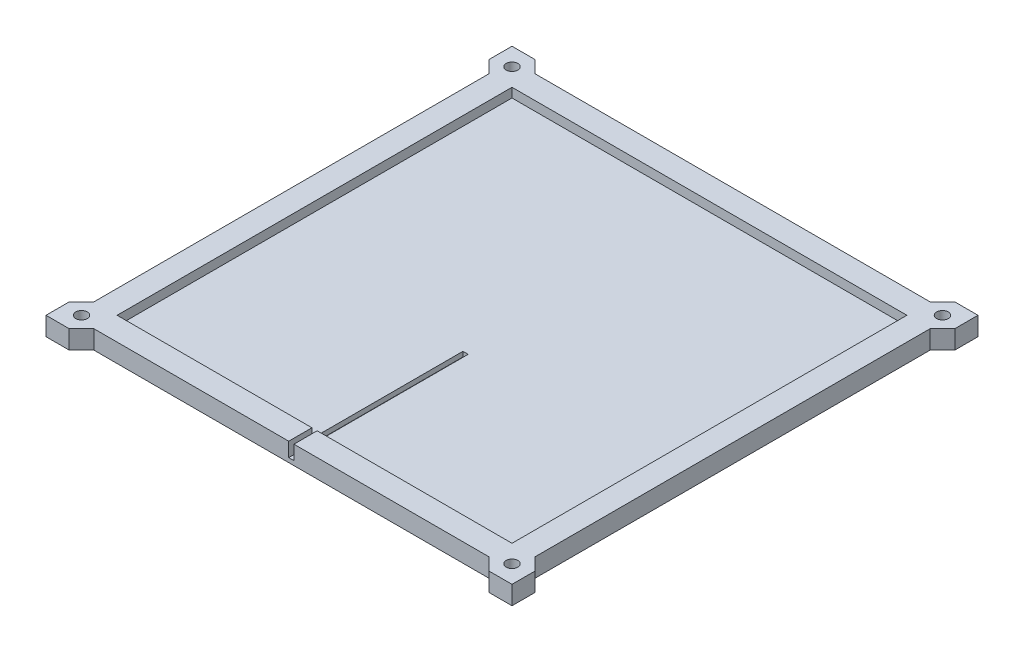
from build123d import *

# Parameters (mm, degrees)
SKETCH1_W            = 380
SKETCH1_H            = 380
BOSS_EXTRUDE1_DEPTH  = 8
SKETCH2_W            = 380
SKETCH2_H            = 380
SKETCH2_W_2          = 340
SKETCH2_H_2          = 340
BOSS_EXTRUDE2_DEPTH  = 8
BOSS_EXTRUDE3_DEPTH  = 16
MIRROR2_COPY_1_DEPTH = 16
SKETCH6_R            = 5
CUT_EXTRUDE1_DEPTH   = 16
SKETCH8_W            = 4.5
SKETCH8_H            = 30
CUT_EXTRUDE2_DEPTH   = 150


with BuildPart() as part:
    # Sketch1 → Boss-Extrude1 (new body)
    with BuildSketch(Plane(origin=(0, 0, 0), x_dir=(1, 0, 0), z_dir=(0, 1, 0))):
        Rectangle(SKETCH1_W, SKETCH1_H)
    extrude(amount=BOSS_EXTRUDE1_DEPTH)

    # Sketch2 → Boss-Extrude2 (add)
    with BuildSketch(Plane(origin=(0, 8, 0), x_dir=(1, 0, 0), z_dir=(0, 1, 0))):
        Rectangle(SKETCH2_W, SKETCH2_H)
        Rectangle(SKETCH2_W_2, SKETCH2_H_2, mode=Mode.SUBTRACT)
    extrude(amount=BOSS_EXTRUDE2_DEPTH)

    # Sketch3 → Boss-Extrude3 (add)
    with BuildSketch(Plane(origin=(0, 16, 0), x_dir=(1, 0, 0), z_dir=(0, 1, 0))):
        Polygon((-200.606601718, 180.606601718), (-190, 170), (-190, 190), (-170, 190), (-180.606601718, 200.606601718), (-200.606601718, 200.606601718), align=None)
    boss_extrude3 = extrude(amount=-BOSS_EXTRUDE3_DEPTH)

    # Mirror1: Boss-Extrude3 across plane
    add(boss_extrude3.mirror(Plane(origin=(0, 0, 0), x_dir=(0, 0, 1), z_dir=(1, 0, 0))))

    # Mirror2: Boss-Extrude3 across plane
    add(boss_extrude3.mirror(Plane.XY))

    # Mirror2 copy 1 sketch → Mirror2 copy 1 (add)
    with BuildSketch(Plane(origin=(0, 16, 0), x_dir=(-1, 0, 0), z_dir=(0, 1, 0))):
        Polygon((-200.606601718, 180.606601718), (-190, 170), (-190, 190), (-170, 190), (-180.606601718, 200.606601718), (-200.606601718, 200.606601718), align=None)
    extrude(amount=-MIRROR2_COPY_1_DEPTH)

    # Sketch6 → Cut-Extrude1 (cut)
    with BuildSketch(Plane(origin=(0, 16, 0), x_dir=(1, 0, 0), z_dir=(0, 1, 0))):
        with Locations(Location((-185.303300859, 185.303300859, 0), (0, 0, 270))):
            Circle(SKETCH6_R)
        with Locations(Location((185.303300859, 185.303300859, 0), (0, 0, 90))):
            Circle(SKETCH6_R)
        with Locations(Location((185.303300859, -185.303300859, 0), (0, 0, 270))):
            Circle(SKETCH6_R)
        with Locations(Location((-185.303300859, -185.303300859, 0), (0, 0, 90))):
            Circle(SKETCH6_R)
    extrude(amount=-CUT_EXTRUDE1_DEPTH, mode=Mode.SUBTRACT)

    # Sketch8 → Cut-Extrude2 (cut)
    with BuildSketch(Plane.XY.offset(190)):
        with Locations((0, 18.75)):
            Rectangle(SKETCH8_W, SKETCH8_H)
    extrude(amount=-CUT_EXTRUDE2_DEPTH, mode=Mode.SUBTRACT)


solid = part.part
